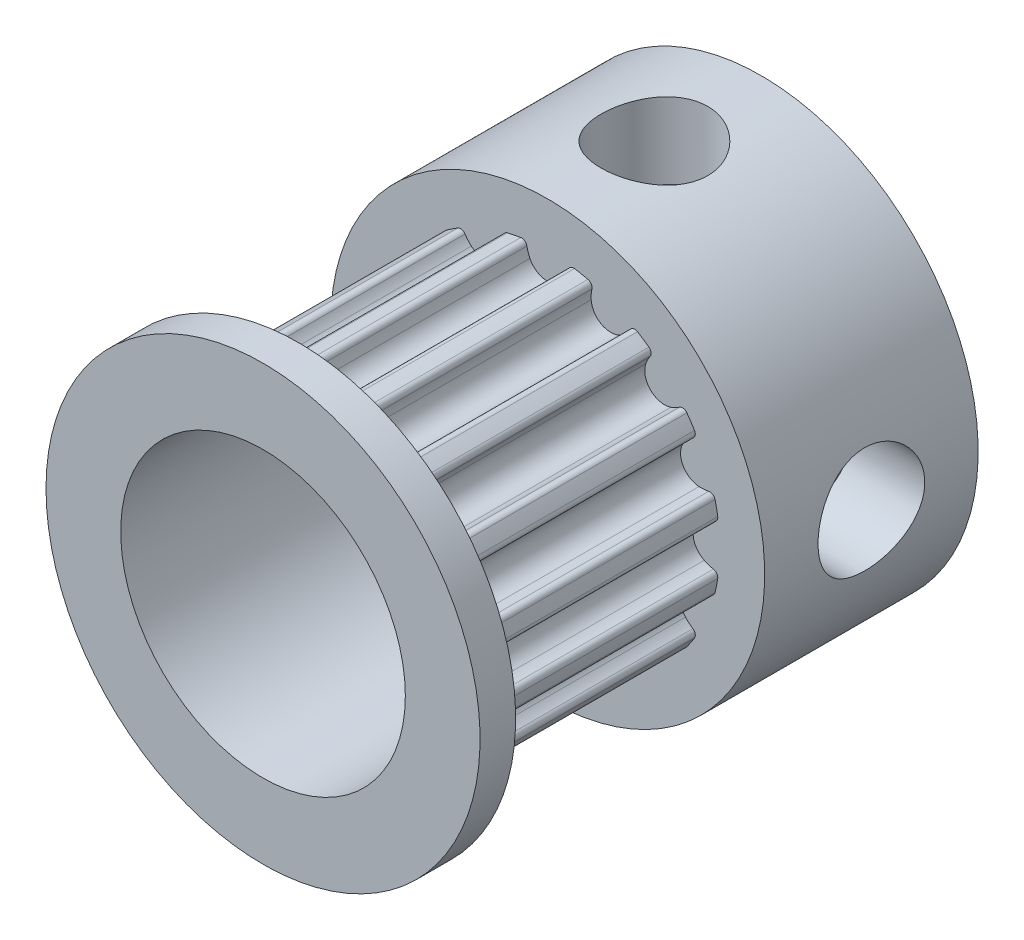
from build123d import *

# Parameters (mm, degrees)
SKETCH1_R           = 4.838958179
BOSS_EXTRUDE1_DEPTH = 3.5
CUT_EXTRUDE1_DEPTH  = 10.789332588
CIRPATTERN1_COUNT   = 16
SKETCH3_R           = 6.1
BOSS_EXTRUDE2_DEPTH = 6
BOSS_EXTRUDE3_START = 1
SKETCH4_R           = 6.1
BOSS_EXTRUDE3_DEPTH = 1
SKETCH5_R           = 4
CUT_EXTRUDE2_DEPTH  = 17.444451952
SKETCH6_R           = 1.5
CUT_EXTRUDE3_DEPTH  = 13.832380917
CIRPATTERN2_COUNT   = 2
CIRPATTERN2_ANGLE   = 90


with BuildPart() as part:
    # Sketch1 → Boss-Extrude1 (new, symmetric)
    with BuildSketch(Plane.XY):
        Circle(SKETCH1_R)
    extrude(amount=BOSS_EXTRUDE1_DEPTH, both=True)

    # Sketch2 → Cut-Extrude1 (cut, symmetric)
    with BuildSketch(Plane.XY.offset(3.5)):
        with BuildLine():
            Line((-0.944033909, 4.745978954), (-0.944033909, 5.245978954))
            Line((-0.944033909, 5.245978954), (0.944033909, 5.245978954))
            Line((0.944033909, 5.245978954), (0.944033909, 4.745978954))
            ThreePointArc((0.944033909, 4.745978954), (0.849455538, 4.76381586), (0.754541121, 4.77976819))
            ThreePointArc((0.754541121, 4.77976819), (0.644428592, 4.753992237), (0.583610041, 4.658649315))
            ThreePointArc((0.583610041, 4.658649315), (0.550034765, 4.526814068), (0.498876404, 4.400755932))
            ThreePointArc((0.498876404, 4.400755932), (0, 4.088958179), (-0.498876404, 4.400755932))
            ThreePointArc((-0.498876404, 4.400755932), (-0.550034765, 4.526814068), (-0.583610041, 4.658649315))
            ThreePointArc((-0.583610041, 4.658649315), (-0.644428592, 4.753992237), (-0.754541121, 4.77976819))
            ThreePointArc((-0.754541121, 4.77976819), (-0.849455538, 4.76381586), (-0.944033909, 4.745978954))
        make_face()
    cut_extrude1 = extrude(amount=CUT_EXTRUDE1_DEPTH, both=True, mode=Mode.SUBTRACT)

    # CirPattern1: Cut-Extrude1 ×16 about axis
    cirpattern1_axis = Axis((0, 0, 0), (0, 0, 1))
    for i in range(1, CIRPATTERN1_COUNT):
        add(cut_extrude1.rotate(cirpattern1_axis, i * 360 / CIRPATTERN1_COUNT), mode=Mode.SUBTRACT)

    # Sketch3 → Boss-Extrude2 (add)
    with BuildSketch(Plane(origin=(0, 0, -3.5), x_dir=(-1, 0, 0), z_dir=(0, 0, -1))):
        Circle(SKETCH3_R)
    extrude(amount=BOSS_EXTRUDE2_DEPTH)

    # Sketch4 → Boss-Extrude3 (add)
    with BuildSketch(Plane.XY.offset(3.5).offset(BOSS_EXTRUDE3_START)):
        with Locations(Location((0, 0, 0), (0, 0, 180))):
            Circle(SKETCH4_R)
    extrude(amount=-BOSS_EXTRUDE3_DEPTH)

    # Sketch5 → Cut-Extrude2 (cut, through all)
    with BuildSketch(Plane.XY.offset(4.5)):
        Circle(SKETCH5_R)
    extrude(amount=-CUT_EXTRUDE2_DEPTH, mode=Mode.SUBTRACT)

    # Sketch6 → Cut-Extrude3 (cut, through all)
    with BuildSketch(Plane(origin=(0, 0, 0), x_dir=(0, 0, -1), z_dir=(1, 0, 0))):
        with Locations(Location((6.5, 0, 0), (0, 0, 180))):
            Circle(SKETCH6_R)
    cut_extrude3 = extrude(amount=CUT_EXTRUDE3_DEPTH, mode=Mode.SUBTRACT)

    # CirPattern2: Cut-Extrude3 ×2 about axis
    cirpattern2_axis = Axis((0, 0, -9.5), (0, 0, 1))
    for i in range(1, CIRPATTERN2_COUNT):
        add(cut_extrude3.rotate(cirpattern2_axis, i * CIRPATTERN2_ANGLE / (CIRPATTERN2_COUNT - 1)), mode=Mode.SUBTRACT)


solid = part.part
